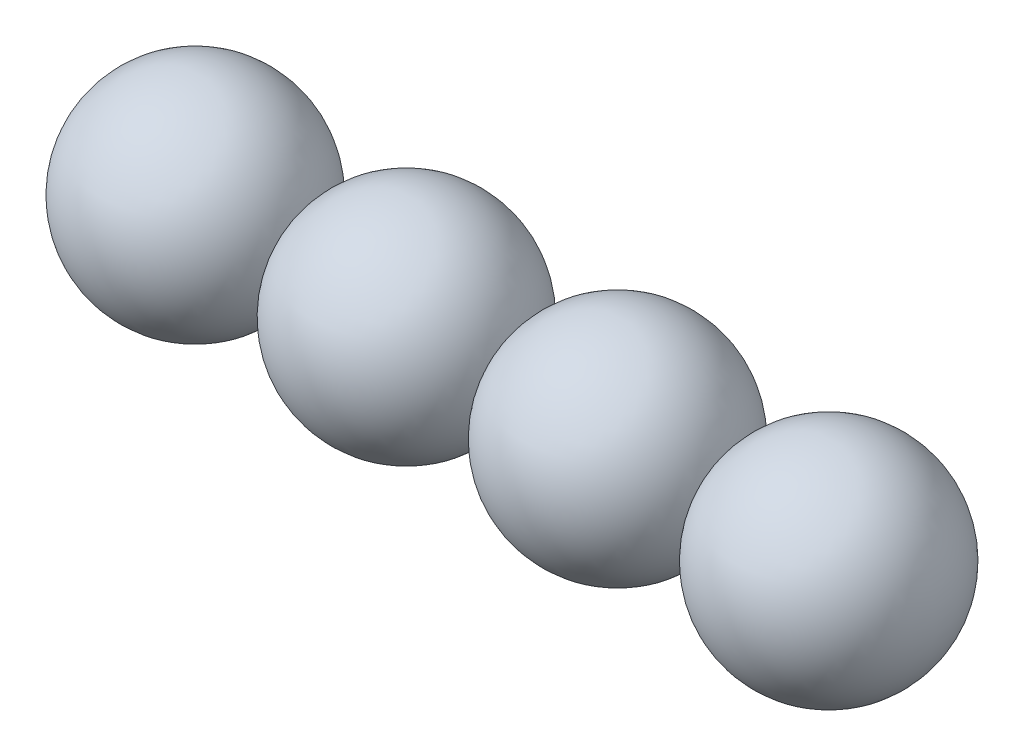
from build123d import *


with BuildPart() as part:
    # 草圖1 → 旋轉1 (revolve)
    with BuildSketch(Plane.XY):
        with BuildLine():
            ThreePointArc((0, -30), (30, 0), (0, 30))
            Line((0, 30), (0, -30))
        make_face()
    revolve(axis=Axis((0, 30, 0), (0, -1, 0)))


with BuildPart() as body_2:
    # 草圖1<8> → 旋轉2 (revolve)
    with BuildSketch(Plane.XY):
        with BuildLine():
            ThreePointArc((60, -30), (90, 0), (60, 30))
            Line((60, 30), (60, -30))
        make_face()
    revolve(axis=Axis((60, 30, 0), (0, -1, 0)))


with BuildPart() as body_3:
    # 草圖1<9> → 旋轉3 (revolve)
    with BuildSketch(Plane.XY):
        with BuildLine():
            ThreePointArc((120.355011354, -29.997899375), (149.999474839, 0.177508784), (120, 30))
            Line((120, 30), (120, -30))
            ThreePointArc((120, -30), (120.177508784, -29.999474839), (120.355011354, -29.997899375))
        make_face()
    revolve(axis=Axis((120, -30, 0), (0, -1, 0)))


with BuildPart() as body_4:
    # 草圖1<10> → 旋轉4 (revolve)
    with BuildSketch(Plane.XY):
        with BuildLine():
            Line((180, 30), (180, -30))
            ThreePointArc((180, -30), (210, 0), (180, 30))
        make_face()
    revolve(axis=Axis((180, 30, 0), (0, -1, 0)))


solid = Compound([part.part, body_2.part, body_3.part, body_4.part])
